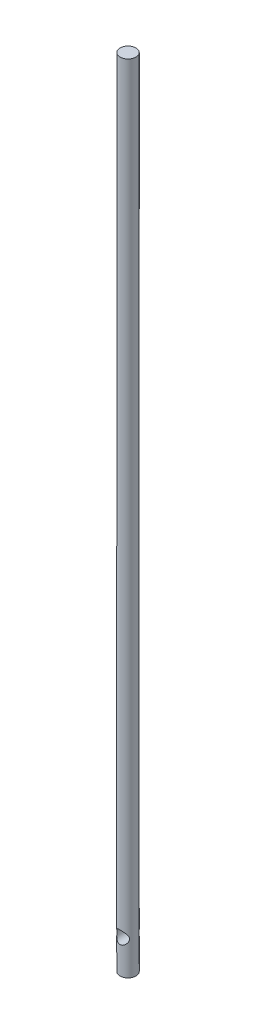
from build123d import *

# Parameters (mm, degrees)
SKETCH_1_R          = 1.5
EXTRUDE_1_DEPTH     = 150
SKETCH_3_R          = 1.2
CUT_EXTRUDE_2_DEPTH = 150
CUT_EXTRUDE_3_DEPTH = 10


with BuildPart() as part:
    # 草图1 → 凸台-拉伸1 (new body)
    with BuildSketch(Plane(origin=(0, 0, 0), x_dir=(1, 0, 0), z_dir=(0, 1, 0))):
        with Locations(Location((0, 0, 0), (0, 0, 270))):
            Circle(SKETCH_1_R)
    extrude(amount=EXTRUDE_1_DEPTH)

    # 草图3 → 切除-拉伸2 (cut, symmetric)
    with BuildSketch(Plane.XY):
        with Locations((0, 6.338597252)):
            Circle(SKETCH_3_R)
    extrude(amount=CUT_EXTRUDE_2_DEPTH, both=True, mode=Mode.SUBTRACT)

    # 草图5 → 切除-拉伸3 (cut)
    with BuildSketch(Plane.XY):
        with BuildLine():
            Line((1.2, 123.985472487), (1.2, 10.930622971))
            ThreePointArc((1.2, 10.930622971), (0, 9.730622971), (-1.2, 10.930622971))
            Line((-1.2, 10.930622971), (-1.2, 123.985472487))
            ThreePointArc((-1.2, 123.985472487), (0, 125.185472487), (1.2, 123.985472487))
        make_face()
    extrude(amount=-CUT_EXTRUDE_3_DEPTH, mode=Mode.SUBTRACT)


solid = part.part
